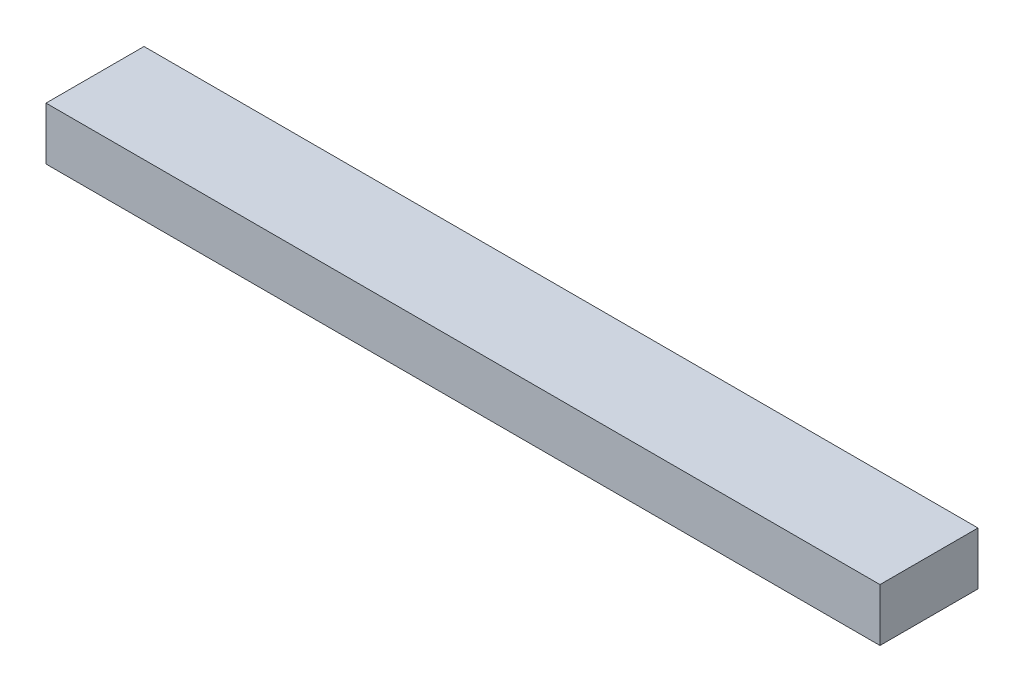
from build123d import *

# Parameters (mm, degrees)
SKETCH_1_W      = 110.6
SKETCH_1_H      = 13
EXTRUDE_1_DEPTH = 7


with BuildPart() as part:
    # 草图1 → 凸台-拉伸1 (new body)
    with BuildSketch(Plane(origin=(0, 0, 0), x_dir=(1, 0, 0), z_dir=(0, 1, 0))):
        with Locations((1.616959064, 15.490643275)):
            Rectangle(SKETCH_1_W, SKETCH_1_H)
    extrude(amount=EXTRUDE_1_DEPTH)


solid = part.part
